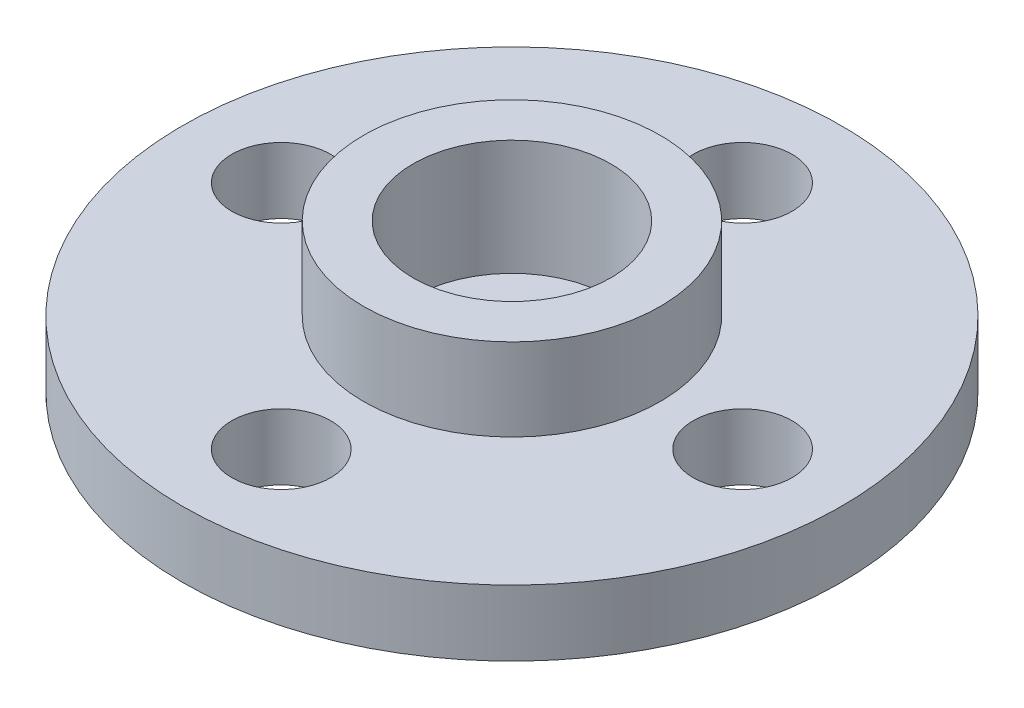
from build123d import *

# Parameters (mm, degrees)
SKETCH_1_R          = 10
SKETCH_1_R_2        = 1.5
EXTRUDE_1_DEPTH     = 2
SKETCH_2_R          = 3
CUT_EXTRUDE_1_DEPTH = 1
EXTRUDE_START       = 2.5
SKETCH_3_R          = 4.5
SKETCH_3_R_2        = 3
EXTRUDE_2_DEPTH     = 2.5


with BuildPart() as part:
    # 草图1 → 凸台-拉伸1 (new body)
    with BuildSketch(Plane(origin=(0, 0, 0), x_dir=(1, 0, 0), z_dir=(0, 1, 0))):
        with Locations(Location((0, 0, 0), (0, 0, 270))):
            Circle(SKETCH_1_R)
        with Locations(Location((0, 7, 0), (0, 0, 270))):
            Circle(SKETCH_1_R_2, mode=Mode.SUBTRACT)
        with Locations(Location((0, 0, 0), (0, 0, 270))):
            Circle(SKETCH_1_R_2, mode=Mode.SUBTRACT)
        with Locations(Location((7, 0, 0), (0, 0, 270))):
            Circle(SKETCH_1_R_2, mode=Mode.SUBTRACT)
        with Locations(Location((0, -7, 0), (0, 0, 270))):
            Circle(SKETCH_1_R_2, mode=Mode.SUBTRACT)
        with Locations(Location((-7, 0, 0), (0, 0, 270))):
            Circle(SKETCH_1_R_2, mode=Mode.SUBTRACT)
    extrude(amount=EXTRUDE_1_DEPTH)

    # 草图2 → 切除-拉伸1 (cut)
    with BuildSketch(Plane(origin=(0, 2, 0), x_dir=(1, 0, 0), z_dir=(0, 1, 0))):
        with Locations(Location((0, 0, 0), (0, 0, 270))):
            Circle(SKETCH_2_R)
    extrude(amount=-CUT_EXTRUDE_1_DEPTH, mode=Mode.SUBTRACT)

    # 草图3 → 凸台-拉伸2 (add)
    with BuildSketch(Plane(origin=(0, 2, 0), x_dir=(1, 0, 0), z_dir=(0, 1, 0)).offset(EXTRUDE_START)):
        with Locations(Location((0, 0, 0), (0, 0, 270))):
            Circle(SKETCH_3_R)
        with Locations(Location((0, 0, 0), (0, 0, 270))):
            Circle(SKETCH_3_R_2, mode=Mode.SUBTRACT)
    extrude(amount=-EXTRUDE_2_DEPTH)


solid = part.part
